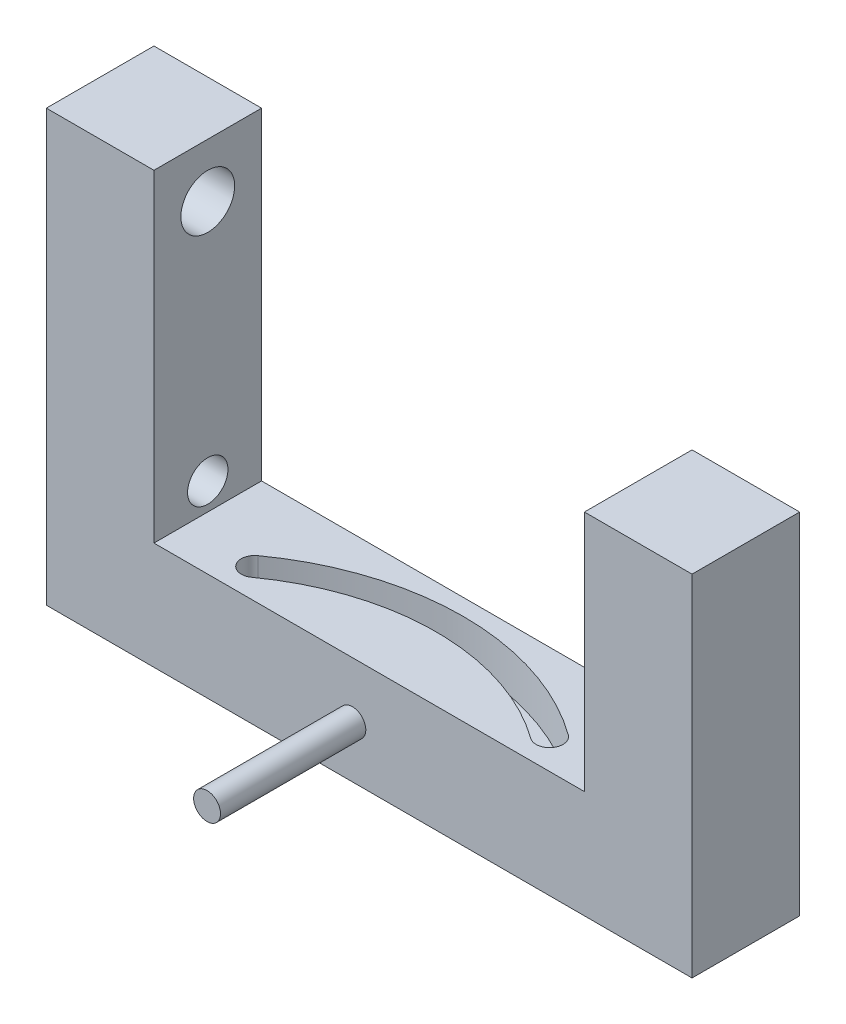
from build123d import *

# Parameters (mm, degrees)
BOSS_EXTRUDE1_DEPTH = 25.4
CUT_EXTRUDE1_REACH  = 369.204
SKETCH2_R           = 12.7
SKETCH3_R           = 9.525
CUT_EXTRUDE2_DEPTH  = 50.8
SKETCH4_R           = 6.35
BOSS_EXTRUDE2_DEPTH = 68.58
CUT_EXTRUDE3_DEPTH  = 19.05


with BuildPart() as part:
    # Sketch1 → Boss-Extrude1 (new, symmetric)
    with BuildSketch(Plane.XY):
        Polygon((0, 0), (0, 203.2), (50.8, 203.2), (50.8, 50.8), (254, 50.8), (254, 165.1), (304.8, 165.1), (304.8, 0), align=None)
    extrude(amount=BOSS_EXTRUDE1_DEPTH, both=True)

    # Sketch2 → Cut-Extrude1 (cut, up to next)
    with BuildSketch(Plane.ZY, mode=Mode.PRIVATE) as cut_extrude1_sk1:
        with Locations((0, 177.8)):
            Circle(SKETCH2_R)
    cut_extrude1_tool1 = extrude(cut_extrude1_sk1.sketch, amount=-CUT_EXTRUDE1_REACH, mode=Mode.PRIVATE) & part.part
    add(cut_extrude1_tool1.solids().sort_by_distance((0, 177.8, 0))[0], mode=Mode.SUBTRACT)

    # Sketch3 → Cut-Extrude2 (cut)
    with BuildSketch(Plane.ZY):
        with Locations((0, 63.5)):
            Circle(SKETCH3_R)
    extrude(amount=-CUT_EXTRUDE2_DEPTH, mode=Mode.SUBTRACT)

    # Sketch4 → Boss-Extrude2 (add)
    with BuildSketch(Plane.XY.offset(25.4)):
        with Locations(Location((144.449989541, 24.404106045, 0), (0, 0, 180))):
            Circle(SKETCH4_R)
    extrude(amount=BOSS_EXTRUDE2_DEPTH)

    # Sketch5 → Cut-Extrude3 (cut)
    with BuildSketch(Plane(origin=(0, 50.8, 0), x_dir=(1, 0, 0), z_dir=(0, 1, 0))):
        with BuildLine():
            ThreePointArc((227.02055062, -6.025839331), (153.726793571, 17.638579798), (80.433036521, -6.025839331))
            ThreePointArc((80.433036521, -6.025839331), (78.995330638, -14.890262707), (87.859754015, -16.32796859))
            ThreePointArc((87.859754015, -16.32796859), (153.726793571, 4.938579798), (219.593833127, -16.32796859))
            ThreePointArc((219.593833127, -16.32796859), (228.458256503, -14.890262707), (227.02055062, -6.025839331))
        make_face()
    extrude(amount=-CUT_EXTRUDE3_DEPTH, mode=Mode.SUBTRACT)


solid = part.part
